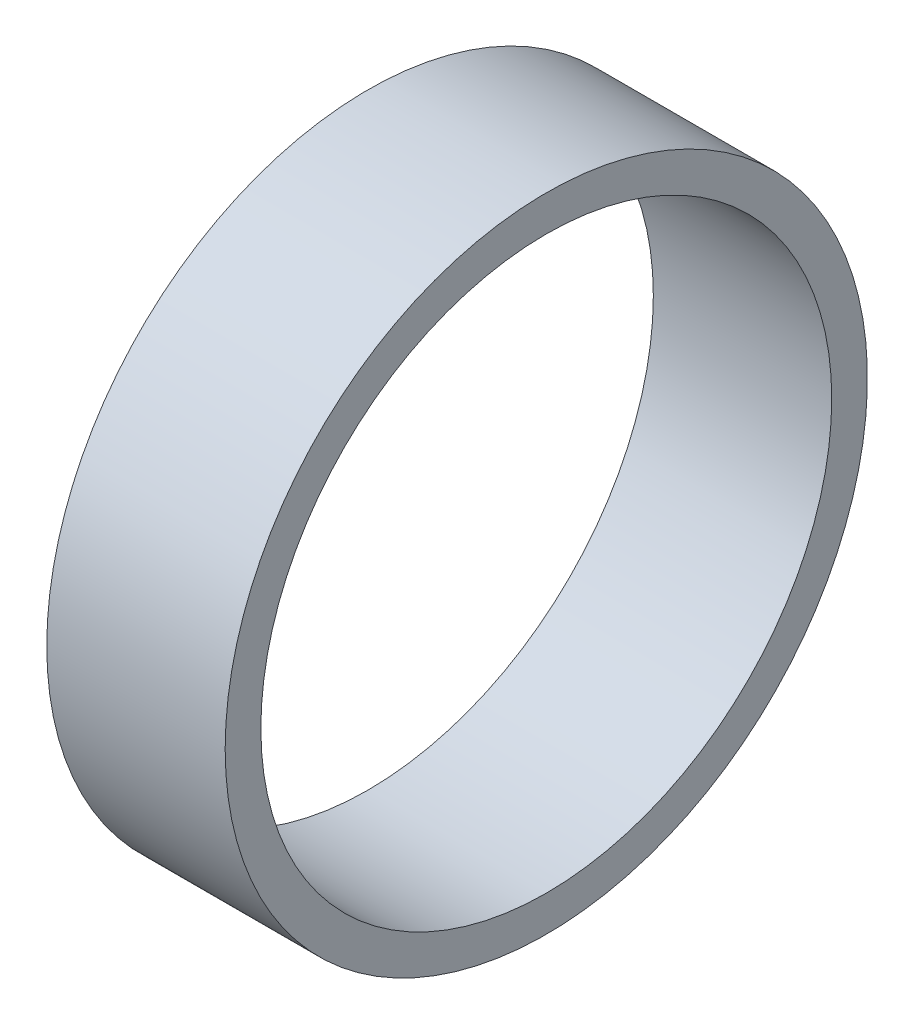
from build123d import *

# Parameters (mm, degrees)
SKETCH1_W = 10
SKETCH1_H = 2


with BuildPart() as part:
    # Sketch1 → Revolve1 (revolve)
    with BuildSketch(Plane(origin=(0, 0, 0), x_dir=(1, 0, 0), z_dir=(0, 1, 0)), mode=Mode.PRIVATE) as revolve1_sk:
        with Locations((5, 17)):
            Rectangle(SKETCH1_W, SKETCH1_H)
    revolve(revolve1_sk.sketch.rotate(Axis((0, 0, 0), (1, 0, 0)), 180), axis=Axis((0, 0, 0), (1, 0, 0)))


solid = part.part
